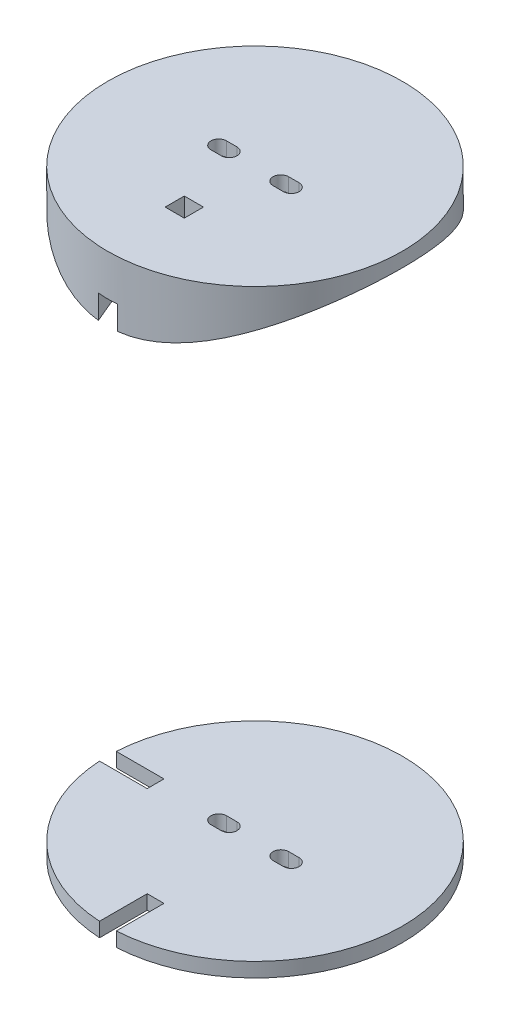
from build123d import *

# Parameters (mm, degrees)
EXTRUDE_1_DEPTH          = 6
EXTRUDE_START            = 150
SKETCH_1_3_R             = 61.5
EXTRUDE_2_DEPTH          = 100
CUT_EXTRUDE_1_DEPTH      = 265.696996583
CUT_EXTRUDE_1_DEPTH_BACK = 265.696996583
CUT_EXTRUDE_2_DEPTH      = 4


with BuildPart() as part:
    # Эскиз1 → Бобышка-Вытянуть1 (new body)
    with BuildSketch(Plane(origin=(0, 0, 0), x_dir=(1, 0, 0), z_dir=(0, 1, 0))):
        with BuildLine():
            ThreePointArc((-61.400325732, -3.5), (-43.487067043, -43.487067043), (-3.5, -61.400325732))
            Line((-3.5, -61.400325732), (-3.5, -41.5))
            Line((-3.5, -41.5), (3.5, -41.5))
            Line((3.5, -41.5), (3.5, -61.400325732))
            ThreePointArc((3.5, -61.400325732), (44.707381941, -42.231504828), (61.5, 0))
            ThreePointArc((61.5, 0), (1.750709496, 61.475076383), (-61.400325732, 3.5))
            Line((-61.400325732, 3.5), (-41.5, 3.5))
            Line((-41.5, 3.5), (-41.5, -3.5))
            Line((-41.5, -3.5), (-61.400325732, -3.5))
        make_face()
        with BuildLine():
            ThreePointArc((-15.15, -3.25), (-18.4, 0), (-15.15, 3.25))
            Line((-15.15, 3.25), (-10.8, 3.25))
            ThreePointArc((-10.8, 3.25), (-7.55, 0), (-10.8, -3.25))
            Line((-10.8, -3.25), (-15.15, -3.25))
        make_face(mode=Mode.SUBTRACT)
        with BuildLine():
            Line((10.8, 3.25), (15.15, 3.25))
            ThreePointArc((15.15, 3.25), (18.4, 0), (15.15, -3.25))
            Line((15.15, -3.25), (10.8, -3.25))
            ThreePointArc((10.8, -3.25), (7.55, 0), (10.8, 3.25))
        make_face(mode=Mode.SUBTRACT)
    extrude(amount=EXTRUDE_1_DEPTH)


with BuildPart() as body_2:
    # Эскиз1<3> → Бобышка-Вытянуть2 (new body)
    with BuildSketch(Plane(origin=(0, 0, 0), x_dir=(1, 0, 0), z_dir=(0, 1, 0)).offset(EXTRUDE_START)):
        Circle(SKETCH_1_3_R)
        with BuildLine():
            ThreePointArc((-15.15, -3.25), (-18.4, 0), (-15.15, 3.25))
            Line((-15.15, 3.25), (-10.8, 3.25))
            ThreePointArc((-10.8, 3.25), (-7.55, 0), (-10.8, -3.25))
            Line((-10.8, -3.25), (-15.15, -3.25))
        make_face(mode=Mode.SUBTRACT)
        with BuildLine():
            Line((10.8, 3.25), (15.15, 3.25))
            ThreePointArc((15.15, 3.25), (18.4, 0), (15.15, -3.25))
            Line((15.15, -3.25), (10.8, -3.25))
            ThreePointArc((10.8, -3.25), (7.55, 0), (10.8, 3.25))
        make_face(mode=Mode.SUBTRACT)
    extrude(amount=EXTRUDE_2_DEPTH)

    # Эскиз3 → Вырез-Вытянуть1 (cut, two sides: drawn at the far end of the back side and taken through both)
    with BuildSketch(Plane(origin=(0, 0, 0), x_dir=(0, 0, -1), z_dir=(1, 0, 0)).offset(-CUT_EXTRUDE_1_DEPTH_BACK)):
        with BuildLine():
            ThreePointArc((100, 144), (61.026381005, 223.219825936), (-25.515616428, 240.689985615))
            ThreePointArc((-25.515616428, 240.689985615), (-44.412514777, 233.596476109), (-61.5, 222.852710797))
            ThreePointArc((-61.5, 222.852710797), (-43.874821937, 54.138996222), (100, 144))
        make_face()
    extrude(amount=CUT_EXTRUDE_1_DEPTH + CUT_EXTRUDE_1_DEPTH_BACK, mode=Mode.SUBTRACT)

    # Эскиз3<3> → Вырез-Вытянуть2 (cut, symmetric)
    with BuildSketch(Plane(origin=(0, 0, 0), x_dir=(0, 0, -1), z_dir=(1, 0, 0))):
        with BuildLine():
            Line((-25.515616428, 240.689985615), (-25.515616428, 250))
            Line((-25.515616428, 250), (-33.515616428, 250))
            Line((-33.515616428, 250), (-33.515616428, 246.667928076))
            ThreePointArc((-33.515616428, 246.667928076), (-48.012663856, 240.740808915), (-61.5, 232.779220542))
            Line((-61.5, 232.779220542), (-61.5, 222.852710797))
            ThreePointArc((-61.5, 222.852710797), (-44.412514777, 233.596476109), (-25.515616428, 240.689985615))
        make_face()
    extrude(amount=CUT_EXTRUDE_2_DEPTH, both=True, mode=Mode.SUBTRACT)


solid = Compound([part.part, body_2.part])
